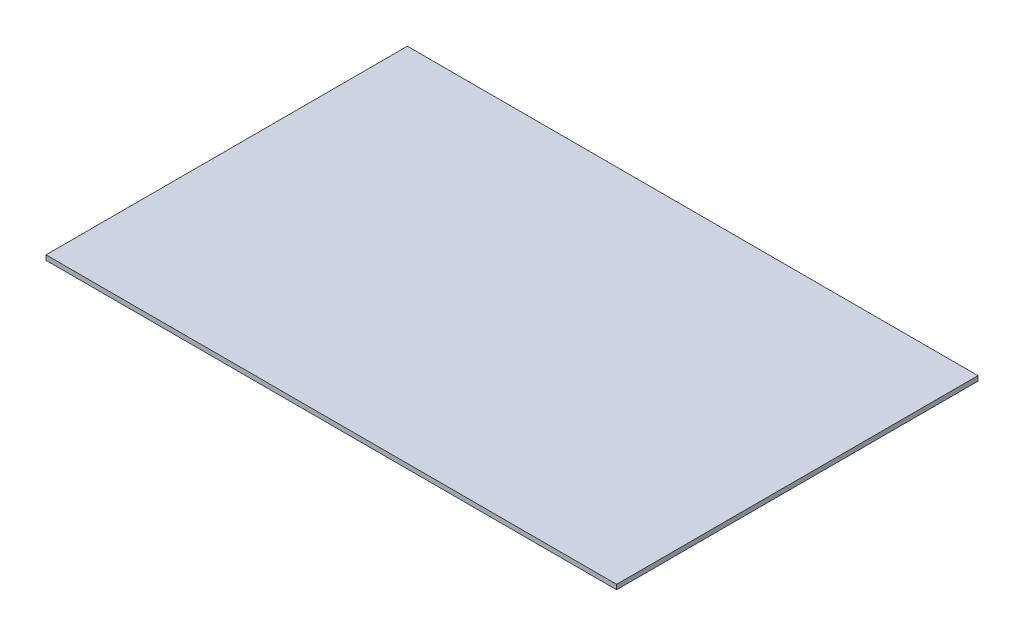
from build123d import *

# Parameters (mm, degrees)
SKETCH1_W           = 240
SKETCH1_H           = 152
BOSS_EXTRUDE1_DEPTH = 2


with BuildPart() as part:
    # Sketch1 → Boss-Extrude1 (new body)
    with BuildSketch(Plane(origin=(0, 0, 0), x_dir=(1, 0, 0), z_dir=(0, 1, 0))):
        Rectangle(SKETCH1_W, SKETCH1_H)
    extrude(amount=BOSS_EXTRUDE1_DEPTH)


solid = part.part
